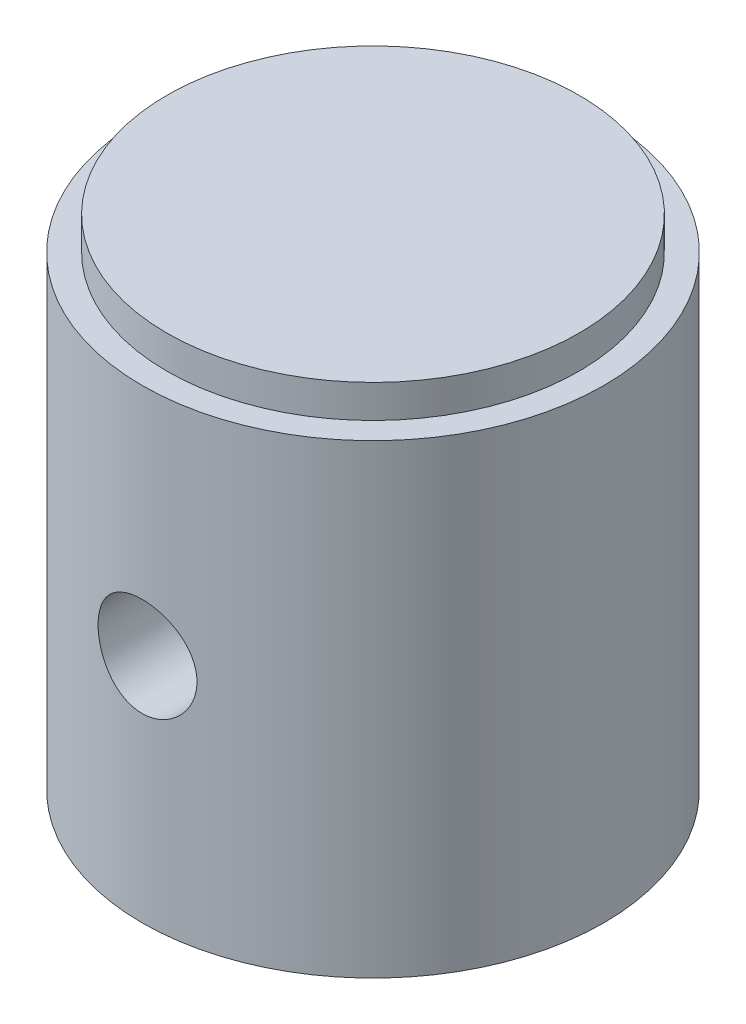
from build123d import *

# Parameters (mm, degrees)
SKETCH2_R          = 1.5
CUT_EXTRUDE2_DEPTH = 7


with BuildPart() as part:
    # Sketch1 → Revolve1 (revolve)
    with BuildSketch(Plane.XY, mode=Mode.PRIVATE) as revolve1_sk:
        Polygon((0, 25.602357553), (0, 27.102357553), (-6.25, 27.102357553), (-6.25, 26.102357553), (-7, 26.102357553), (-7, 11.986662945), (-5.839130901, 11.986662945), (-5.11205907, 13.984276384), (-4.391648147, 15.963589129), (-4.391648147, 18.963589129), (-4.391648147, 22.963589129), align=None)
    revolve(revolve1_sk.sketch.rotate(Axis((0, -49.511916915, 0), (0, 1, 0)), 90), axis=Axis((0, -49.511916915, 0), (0, 1, 0)))

    # Sketch2 → Cut-Extrude2 (cut, symmetric)
    with BuildSketch(Plane.XY):
        with Locations((0, 18.986662945)):
            Circle(SKETCH2_R)
    extrude(amount=CUT_EXTRUDE2_DEPTH, both=True, mode=Mode.SUBTRACT)


solid = part.part
